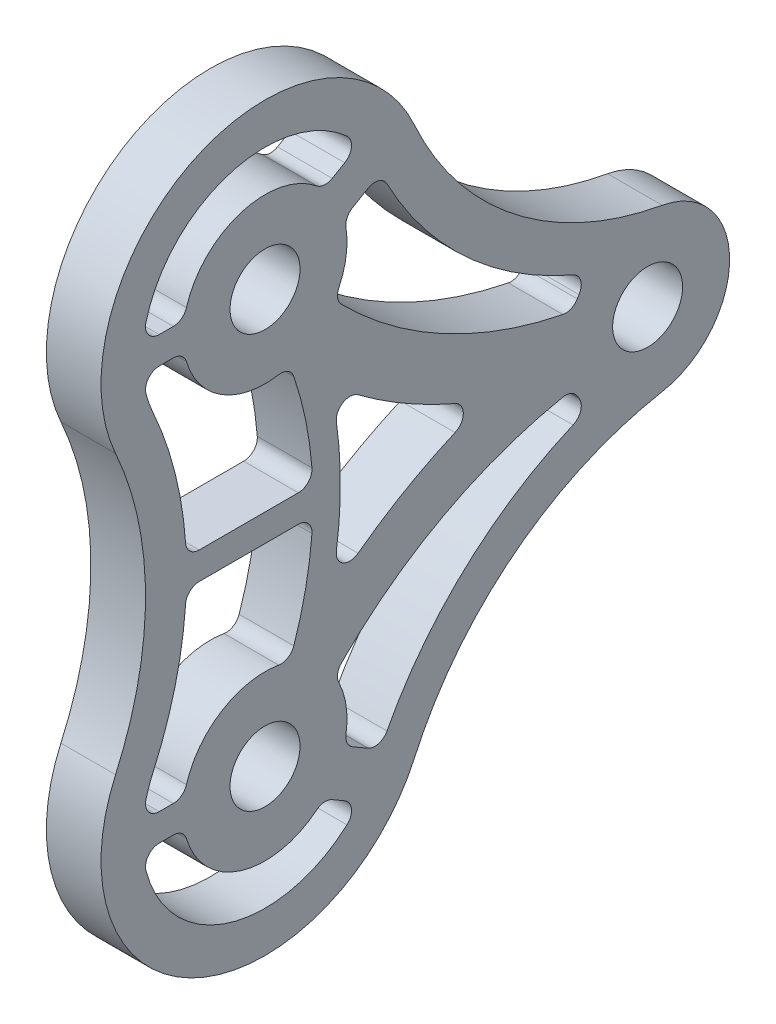
from build123d import *

# Parameters (mm, degrees)
SKETCH1_R           = 2.032
BOSS_EXTRUDE1_DEPTH = 3.175
CUT_EXTRUDE3_DEPTH  = 44.154737935
FILLET7_R           = 0.79375


with BuildPart() as part:
    # Sketch1 → Boss-Extrude1 (new body)
    with BuildSketch(Plane(origin=(0, 0, 0), x_dir=(0, 0, -1), z_dir=(1, 0, 0))):
        with BuildLine():
            ThreePointArc((8.680611479, 3.920791929), (-3.920791929, 8.680611479), (-8.680611479, -3.920791929))
            ThreePointArc((-8.680611479, -3.920791929), (-6.940659276, -12), (-8.680611479, -20.079208071))
            ThreePointArc((-8.680611479, -20.079208071), (-3.920791929, -32.680611479), (8.680611479, -27.920791929))
            ThreePointArc((8.680611479, -27.920791929), (14.490977925, -20.528185893), (23.073028322, -16.686390318))
            ThreePointArc((23.073028322, -16.686390318), (26.9875, -12), (23.073028322, -7.313609682))
            ThreePointArc((23.073028322, -7.313609682), (14.490977925, -3.471814107), (8.680611479, 3.920791929))
        make_face()
        Circle(SKETCH1_R, mode=Mode.SUBTRACT)
        with Locations((0, -24)):
            Circle(SKETCH1_R, mode=Mode.SUBTRACT)
        with Locations((22.225, -12)):
            Circle(SKETCH1_R, mode=Mode.SUBTRACT)
    extrude(amount=BOSS_EXTRUDE1_DEPTH)

    # Sketch3 → Cut-Extrude3 (cut, through all)
    with BuildSketch(Plane(origin=(3.175, 0, 0), x_dir=(0, 0, -1), z_dir=(1, 0, 0))):
        with BuildLine():
            Line((2.77640068, -12.79375), (-4.573727457, -12.79375))
            ThreePointArc((-4.573727457, -12.79375), (-5.13976897, -17.020846835), (-6.510458609, -21.059406053))
            ThreePointArc((-6.510458609, -21.059406053), (-6.889128086, -22.109741213), (-7.099515829, -23.20625))
            Line((-7.099515829, -23.20625), (-4.695888328, -23.20625))
            ThreePointArc((-4.695888328, -23.20625), (-2.486660202, -19.938235939), (1.428544013, -19.456799778))
            ThreePointArc((1.428544013, -19.456799778), (2.372808927, -16.179960802), (2.77640068, -12.79375))
        make_face()
        with BuildLine():
            Line((-4.573727457, -11.20625), (2.77640068, -11.20625))
            ThreePointArc((2.77640068, -11.20625), (2.372808927, -7.820039198), (1.428544013, -4.543200222))
            ThreePointArc((1.428544013, -4.543200222), (-2.486660202, -4.061764061), (-4.695888328, -0.79375))
            Line((-4.695888328, -0.79375), (-7.099515829, -0.79375))
            ThreePointArc((-7.099515829, -0.79375), (-6.889128086, -1.890258787), (-6.510458609, -2.940593947))
            ThreePointArc((-6.510458609, -2.940593947), (-5.13976897, -6.979153165), (-4.573727457, -11.20625))
        make_face()
        with BuildLine():
            Line((-4.695888328, -24.79375), (-7.099515829, -24.79375))
            ThreePointArc((-7.099515829, -24.79375), (-2.041764358, -30.845755062), (5.504825378, -28.553027742))
            Line((5.504825378, -28.553027742), (3.398165154, -27.336746895))
            ThreePointArc((3.398165154, -27.336746895), (-1.427490687, -28.543531291), (-4.695888328, -24.79375))
        make_face()
        with BuildLine():
            Line((4.588790154, -25.274523902), (6.714488754, -26.501796561))
            ThreePointArc((6.714488754, -26.501796561), (11.712923036, -19.761040761), (18.871091508, -15.38122819))
            ThreePointArc((18.871091508, -15.38122819), (18.31483508, -14.718826318), (17.88756428, -13.966737813))
            ThreePointArc((17.88756428, -13.966737813), (10.350383671, -16.588497048), (4.023738186, -21.452268213))
            ThreePointArc((4.023738186, -21.452268213), (4.71129714, -23.303519195), (4.588790154, -25.274523902))
        make_face()
        with BuildLine():
            Line((4.588790154, 1.274523902), (6.714488754, 2.501796561))
            ThreePointArc((6.714488754, 2.501796561), (11.712923036, -4.238959239), (18.871091508, -8.61877181))
            ThreePointArc((18.871091508, -8.61877181), (18.31483508, -9.281173682), (17.88756428, -10.033262187))
            ThreePointArc((17.88756428, -10.033262187), (10.350383671, -7.411502952), (4.023738186, -2.547731787))
            ThreePointArc((4.023738186, -2.547731787), (4.71129714, -0.696480805), (4.588790154, 1.274523902))
        make_face()
        with BuildLine():
            Line((3.398165154, 3.336746895), (5.504825378, 4.553027742))
            ThreePointArc((5.504825378, 4.553027742), (-2.041764358, 6.845755062), (-7.099515829, 0.79375))
            Line((-7.099515829, 0.79375), (-4.695888328, 0.79375))
            ThreePointArc((-4.695888328, 0.79375), (-1.427490687, 4.543531291), (3.398165154, 3.336746895))
        make_face()
        with BuildLine():
            ThreePointArc((12.902140584, -12), (8.071464849, -9.77354661), (3.745451164, -6.678691468))
            ThreePointArc((3.745451164, -6.678691468), (4.378848612, -12), (3.745451164, -17.321308532))
            ThreePointArc((3.745451164, -17.321308532), (8.071464849, -14.22645339), (12.902140584, -12))
        make_face()
    extrude(amount=-CUT_EXTRUDE3_DEPTH, mode=Mode.SUBTRACT)

    # Fillet7
    fillet7_edges = [part.edges().sort_by_distance(p)[0] for p in [
        (1.5875, 3.336746895, -3.398165154),
        (1.5875, 0.79375, 4.695888328),
        (1.5875, 0.79375, 7.099515829),
        (1.5875, 4.553027742, -5.504825378),
        (1.5875, -21.452268213, -4.023738186),
        (1.5875, -13.966737813, -17.88756428),
        (1.5875, -15.38122819, -18.871091508),
        (1.5875, -26.501796561, -6.714488754),
        (1.5875, -25.274523902, -4.588790154),
        (1.5875, -12, -12.902140584),
        (1.5875, -17.321308532, -3.745451164),
        (1.5875, -6.678691468, -3.745451164),
        (1.5875, -23.20625, 7.099515829),
        (1.5875, -12.79375, 4.573727457),
        (1.5875, -12.79375, -2.77640068),
        (1.5875, -19.456799778, -1.428544013),
        (1.5875, -23.20625, 4.695888328),
        (1.5875, 2.501796561, -6.714488754),
        (1.5875, -8.61877181, -18.871091508),
        (1.5875, -10.033262187, -17.88756428),
        (1.5875, -2.547731787, -4.023738186),
        (1.5875, 1.274523902, -4.588790154),
        (1.5875, -11.20625, 4.573727457),
        (1.5875, -0.79375, 7.099515829),
        (1.5875, -0.79375, 4.695888328),
        (1.5875, -4.543200222, -1.428544013),
        (1.5875, -11.20625, -2.77640068),
        (1.5875, -24.79375, 4.695888328),
        (1.5875, -27.336746895, -3.398165154),
        (1.5875, -28.553027742, -5.504825378),
        (1.5875, -24.79375, 7.099515829),
    ]]
    fillet(fillet7_edges, radius=FILLET7_R)


solid = part.part
